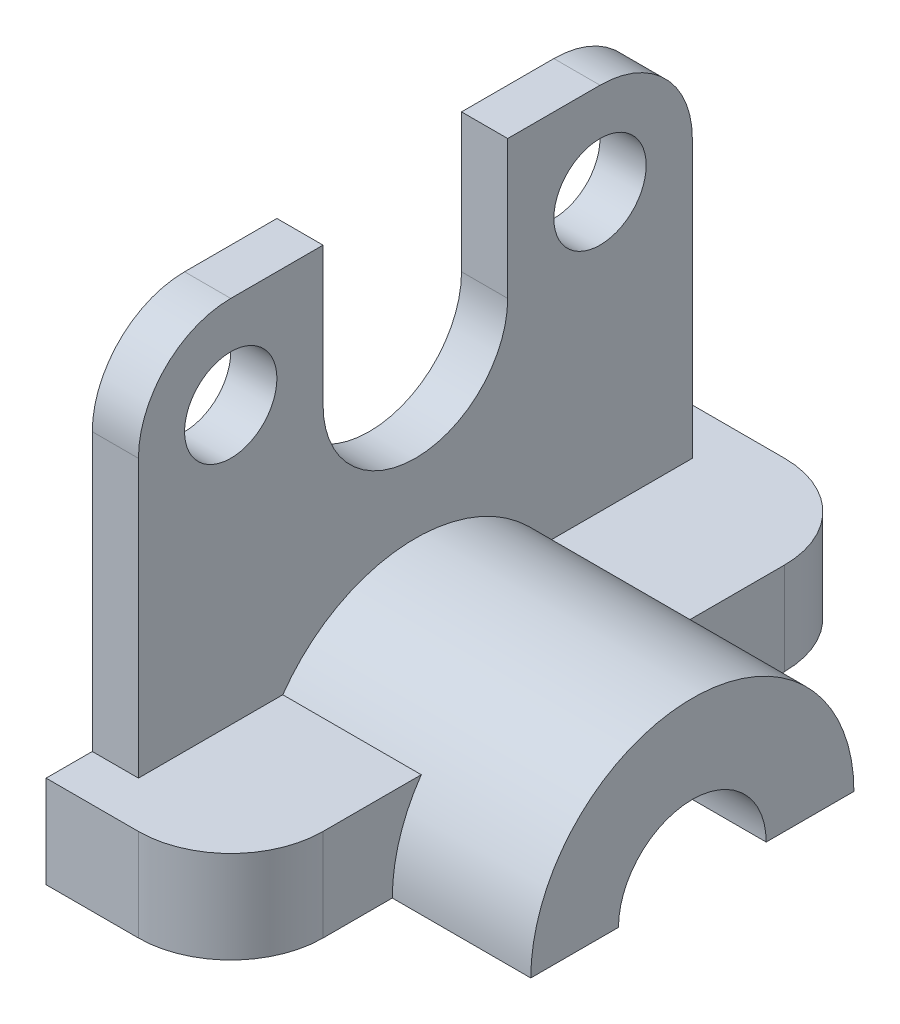
from build123d import *

# Parameters (mm, degrees)
EXTRUDE_1_DEPTH     = 20
EXTRUDE_2_DEPTH     = 5
FILLET_1_R          = 10
SKETCH_2_R          = 5
CUT_EXTRUDE_1_DEPTH = 83.006097334
EXTRUDE_5_REACH     = 120.066
EXTRUDE_START       = 35
SKETCH_5_R          = 8
CUT_EXTRUDE_2_DEPTH = 84.066238629


with BuildPart() as part:
    # 草圖1 → 填料-伸長1 (new body)
    with BuildSketch(Plane(origin=(0, 0, 0), x_dir=(0, 0, -1), z_dir=(1, 0, 0))):
        Polygon((5, 0), (0, 0), (0, -10), (35, -10), (35, 0), align=None)
        Polygon((65, 0), (35, 0), (35, -10), (70, -10), (70, 0), align=None)
    extrude(amount=EXTRUDE_1_DEPTH)

    # 草圖1<3> → 填料-伸長2 (add)
    with BuildSketch(Plane(origin=(0, 0, 0), x_dir=(0, 0, -1), z_dir=(1, 0, 0))):
        with BuildLine():
            Line((5, 30), (5, 0))
            Line((5, 0), (35, 0))
            Line((35, 0), (35, 15))
            ThreePointArc((35, 15), (27.928932188, 17.928932188), (25, 25))
            Line((25, 25), (25, 40))
            Line((25, 40), (15, 40))
            ThreePointArc((15, 40), (7.928932188, 37.071067812), (5, 30))
        make_face()
        with BuildLine():
            Line((35, 15), (35, 0))
            Line((35, 0), (65, 0))
            Line((65, 0), (65, 30))
            ThreePointArc((65, 30), (62.071067812, 37.071067812), (55, 40))
            Line((55, 40), (45, 40))
            Line((45, 40), (45, 25))
            ThreePointArc((45, 25), (42.071067812, 17.928932188), (35, 15))
        make_face()
    extrude(amount=EXTRUDE_2_DEPTH)

    # 圓角1
    fillet_1_edges = [part.edges().sort_by_distance(p)[0] for p in [
        (20, -5, 0),
        (20, -5, -70),
    ]]
    fillet(fillet_1_edges, radius=FILLET_1_R)

    # 草圖2 → 除料-伸長1 (cut, through all)
    with BuildSketch(Plane(origin=(5, 0, 0), x_dir=(0, 0, -1), z_dir=(1, 0, 0))):
        with Locations((15, 30)):
            Circle(SKETCH_2_R)
        with Locations((55, 30)):
            Circle(SKETCH_2_R)
    extrude(amount=-CUT_EXTRUDE_1_DEPTH, mode=Mode.SUBTRACT)

    # 填料-伸長5: up to this face of the body (flat: up to its plane)
    extrude_5_end = Plane(part.part.faces().sort_by_distance((5, 32.5, -24.278889745))[0])
    # 草圖3 → 填料-伸長5 (add, up to the picked face)
    with BuildSketch(Plane(origin=(0, 0, 0), x_dir=(0, 0, -1), z_dir=(1, 0, 0)).offset(EXTRUDE_START), mode=Mode.PRIVATE) as extrude_5_sk1:
        with BuildLine():
            Line((17.5, -10), (27, -10))
            ThreePointArc((27, -10), (35, -2), (43, -10))
            Line((43, -10), (52.5, -10))
            ThreePointArc((52.5, -10), (35, 7.5), (17.5, -10))
        make_face()
    extrude_5_tool1 = split(extrude(extrude_5_sk1.sketch, amount=-EXTRUDE_5_REACH, mode=Mode.PRIVATE), bisect_by=extrude_5_end, keep=Keep.BOTH, mode=Mode.PRIVATE)
    add(extrude_5_tool1.solids().sort_by(Axis((35, -1.507575, -35), (-1, 0, 0)))[0])

    # 草圖5 → 除料-伸長2 (cut, through all)
    with BuildSketch(Plane(origin=(20, 0, 0), x_dir=(0, 0, -1), z_dir=(1, 0, 0))):
        with Locations((35, -10)):
            Circle(SKETCH_5_R)
    extrude(amount=-CUT_EXTRUDE_2_DEPTH, mode=Mode.SUBTRACT)


solid = part.part
